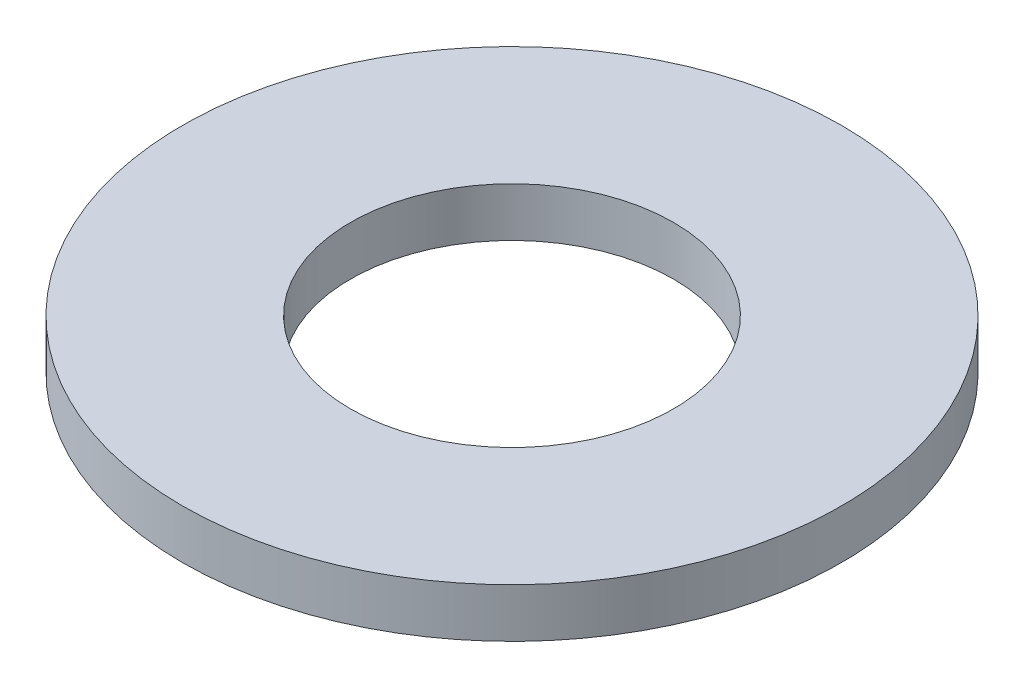
from build123d import *

# Parameters (mm, degrees)
SKETCH1_R           = 3.2385
BOSS_EXTRUDE1_DEPTH = 0.4826
SKETCH5_R           = 1.5875
CUT_EXTRUDE1_DEPTH  = 5.605286881


with BuildPart() as part:
    # Sketch1 → Boss-Extrude1 (new body)
    with BuildSketch(Plane(origin=(0, 0, 0), x_dir=(1, 0, 0), z_dir=(0, 1, 0))):
        with Locations(Location((0, 0, 0), (0, 0, 90))):
            Circle(SKETCH1_R)
    extrude(amount=BOSS_EXTRUDE1_DEPTH)

    # Sketch5 → Cut-Extrude1 (cut, through all)
    with BuildSketch(Plane(origin=(0, 0.4826, 0), x_dir=(-1, 0, 0), z_dir=(0, 1, 0))):
        with Locations(Location((0, 0, 0), (0, 0, 90))):
            Circle(SKETCH5_R)
    extrude(amount=-CUT_EXTRUDE1_DEPTH, mode=Mode.SUBTRACT)


solid = part.part
